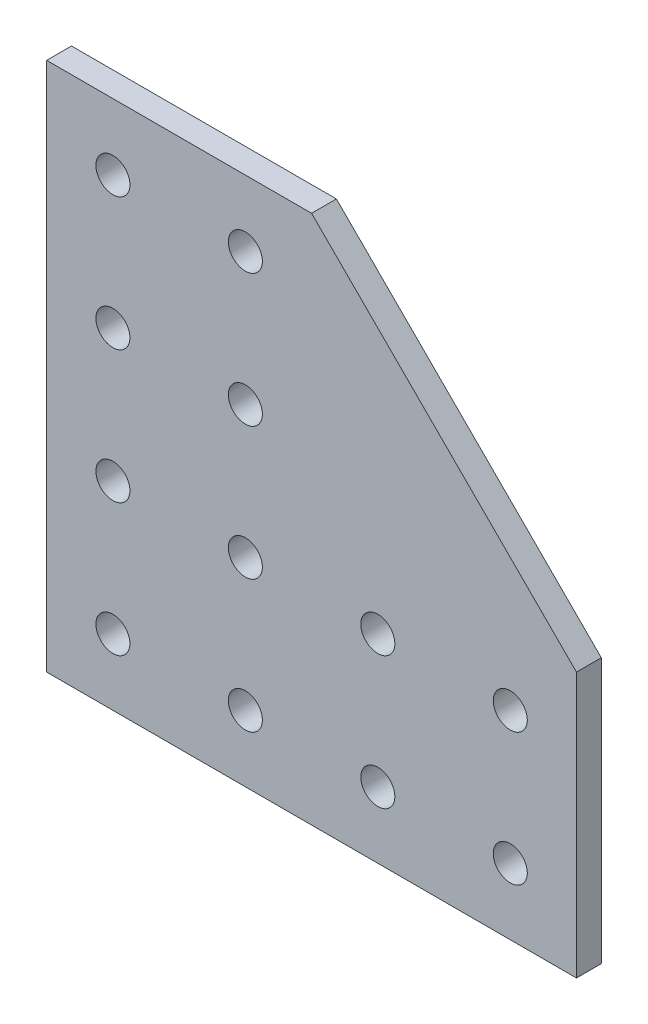
from build123d import *

# Parameters (mm, degrees)
SKETCH1_R           = 3.2639
BOSS_EXTRUDE1_DEPTH = 2.38125


with BuildPart() as part:
    # Sketch1 → Boss-Extrude1 (new, symmetric)
    with BuildSketch(Plane.XY):
        Polygon((0, 0), (0, 101.6), (50.8, 101.6), (101.6, 50.8), (101.6, 0), align=None)
        with Locations((12.7, 12.7)):
            Circle(SKETCH1_R, mode=Mode.SUBTRACT)
        with Locations((38.1, 12.7)):
            Circle(SKETCH1_R, mode=Mode.SUBTRACT)
        with Locations((63.5, 12.7)):
            Circle(SKETCH1_R, mode=Mode.SUBTRACT)
        with Locations((12.7, 38.1)):
            Circle(SKETCH1_R, mode=Mode.SUBTRACT)
        with Locations((12.7, 63.5)):
            Circle(SKETCH1_R, mode=Mode.SUBTRACT)
        with Locations((88.9, 12.7)):
            Circle(SKETCH1_R, mode=Mode.SUBTRACT)
        with Locations((88.9, 38.1)):
            Circle(SKETCH1_R, mode=Mode.SUBTRACT)
        with Locations((63.5, 38.1)):
            Circle(SKETCH1_R, mode=Mode.SUBTRACT)
        with Locations((38.1, 38.1)):
            Circle(SKETCH1_R, mode=Mode.SUBTRACT)
        with Locations((12.7, 88.9)):
            Circle(SKETCH1_R, mode=Mode.SUBTRACT)
        with Locations((38.1, 88.9)):
            Circle(SKETCH1_R, mode=Mode.SUBTRACT)
        with Locations((38.1, 63.5)):
            Circle(SKETCH1_R, mode=Mode.SUBTRACT)
    extrude(amount=BOSS_EXTRUDE1_DEPTH, both=True)


solid = part.part
